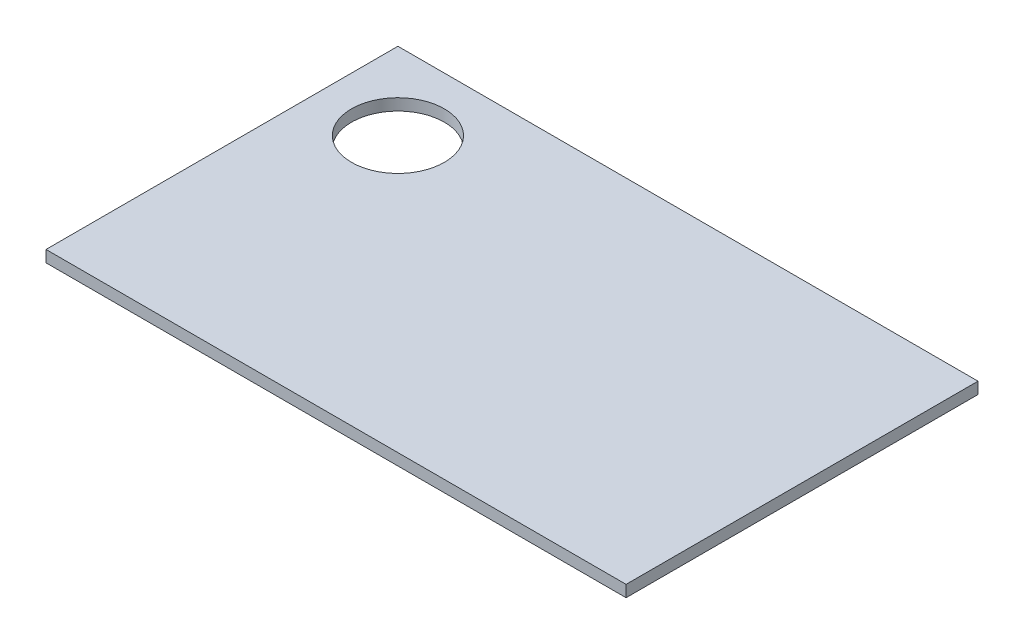
from build123d import *

# Parameters (mm, degrees)
SKETCH3_W           = 952.5
SKETCH3_H           = 577.85
BOSS_EXTRUDE2_DEPTH = 19.05
SKETCH4_R           = 76.2
CUT_EXTRUDE1_DEPTH  = 563.360531599


with BuildPart() as part:
    # Sketch3 → Boss-Extrude2 (new body)
    with BuildSketch(Plane(origin=(0, 711.2, 0), x_dir=(1, 0, 0), z_dir=(0, 1, 0))):
        with Locations((0, 9.525)):
            Rectangle(SKETCH3_W, SKETCH3_H)
    extrude(amount=-BOSS_EXTRUDE2_DEPTH)

    # Sketch4 → Cut-Extrude1 (cut, through all)
    with BuildSketch(Plane(origin=(0, 711.2, 0), x_dir=(1, 0, 0), z_dir=(0, 1, 0))):
        with Locations(Location((-349.25, 171.45, 0), (0, 0, 270))):
            Circle(SKETCH4_R)
    extrude(amount=-CUT_EXTRUDE1_DEPTH, mode=Mode.SUBTRACT)


solid = part.part
